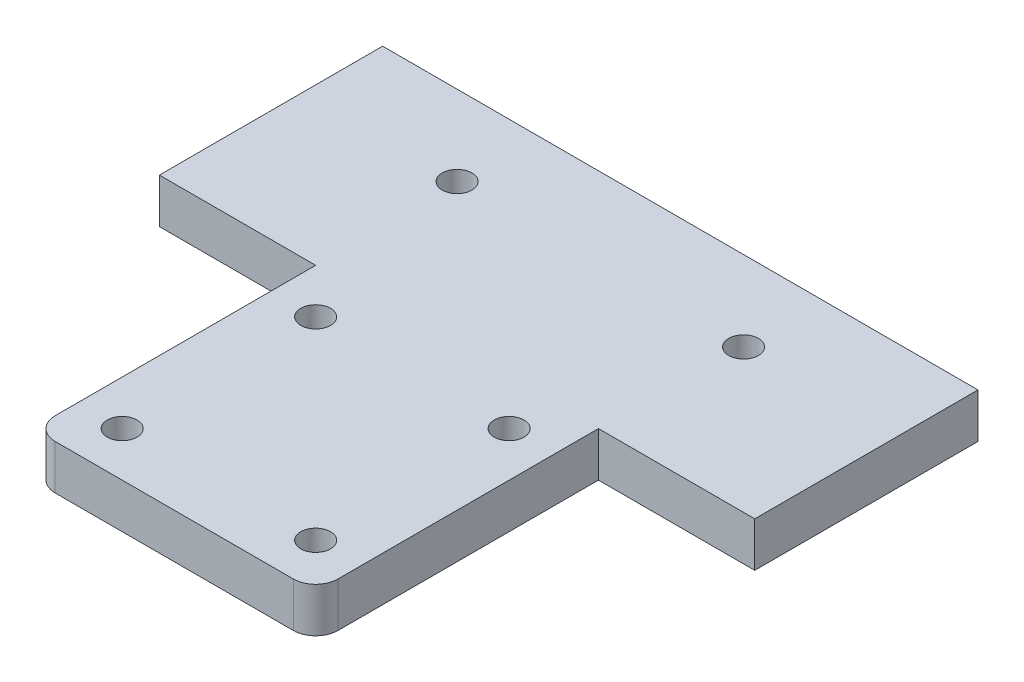
from build123d import *

# Parameters (mm, degrees)
SKETCH1_W            = 38
SKETCH1_H            = 38
BOSS_EXTRUDE1_DEPTH  = 6
SKETCH2_R            = 2
CUT_EXTRUDE1_DEPTH   = 55.074023338
LPATTERN1_COUNT      = 2
LPATTERN1_PITCH      = 26
LPATTERN1_COUNT_DIR2 = 2
LPATTERN1_PITCH_DIR2 = 26
FILLET1_R            = 3
BOSS_EXTRUDE2_DEPTH  = 6
SKETCH4_R            = 2
CUT_EXTRUDE2_DEPTH   = 91.227490268


with BuildPart() as part:
    # Sketch1 → Boss-Extrude1 (new body)
    with BuildSketch(Plane(origin=(0, 0, 0), x_dir=(1, 0, 0), z_dir=(0, 1, 0))):
        with Locations((19, 19)):
            Rectangle(SKETCH1_W, SKETCH1_H)
    extrude(amount=BOSS_EXTRUDE1_DEPTH)

    # Sketch2 → Cut-Extrude1 (cut, through all)
    with BuildSketch(Plane(origin=(0, 6, 0), x_dir=(1, 0, 0), z_dir=(0, 1, 0))):
        with Locations(Location((6, 32, 0), (0, 0, 270))):
            Circle(SKETCH2_R)
    cut_extrude1 = extrude(amount=-CUT_EXTRUDE1_DEPTH, mode=Mode.SUBTRACT)

    # LPattern1: Cut-Extrude1 2 × 2
    with Locations(*[(i * LPATTERN1_PITCH, 0, j * LPATTERN1_PITCH_DIR2) for i in range(LPATTERN1_COUNT) for j in range(LPATTERN1_COUNT_DIR2) if (i, j) != (0, 0)]):
        add(cut_extrude1, mode=Mode.SUBTRACT)

    # Fillet1
    fillet1_edges = [part.edges().sort_by_distance(p)[0] for p in [
        (38, 3, 0),
        (0, 3, 0),
    ]]
    fillet(fillet1_edges, radius=FILLET1_R)

    # Sketch3 → Boss-Extrude2 (add)
    with BuildSketch(Plane(origin=(0, 0, 0), x_dir=(1, 0, 0), z_dir=(0, 1, 0))):
        Polygon((0, 38), (-21, 38), (-21, 68), (59, 68), (59, 38), (38, 38), align=None)
    extrude(amount=BOSS_EXTRUDE2_DEPTH)

    # Sketch4 → Cut-Extrude2 (cut, through all)
    with BuildSketch(Plane(origin=(0, 6, 0), x_dir=(1, 0, 0), z_dir=(0, 1, 0))):
        with Locations(Location((-0.25, 57.25, 0), (0, 0, 270))):
            Circle(SKETCH4_R)
        with Locations(Location((38.25, 57.25, 0), (0, 0, 270))):
            Circle(SKETCH4_R)
    extrude(amount=-CUT_EXTRUDE2_DEPTH, mode=Mode.SUBTRACT)


solid = part.part
